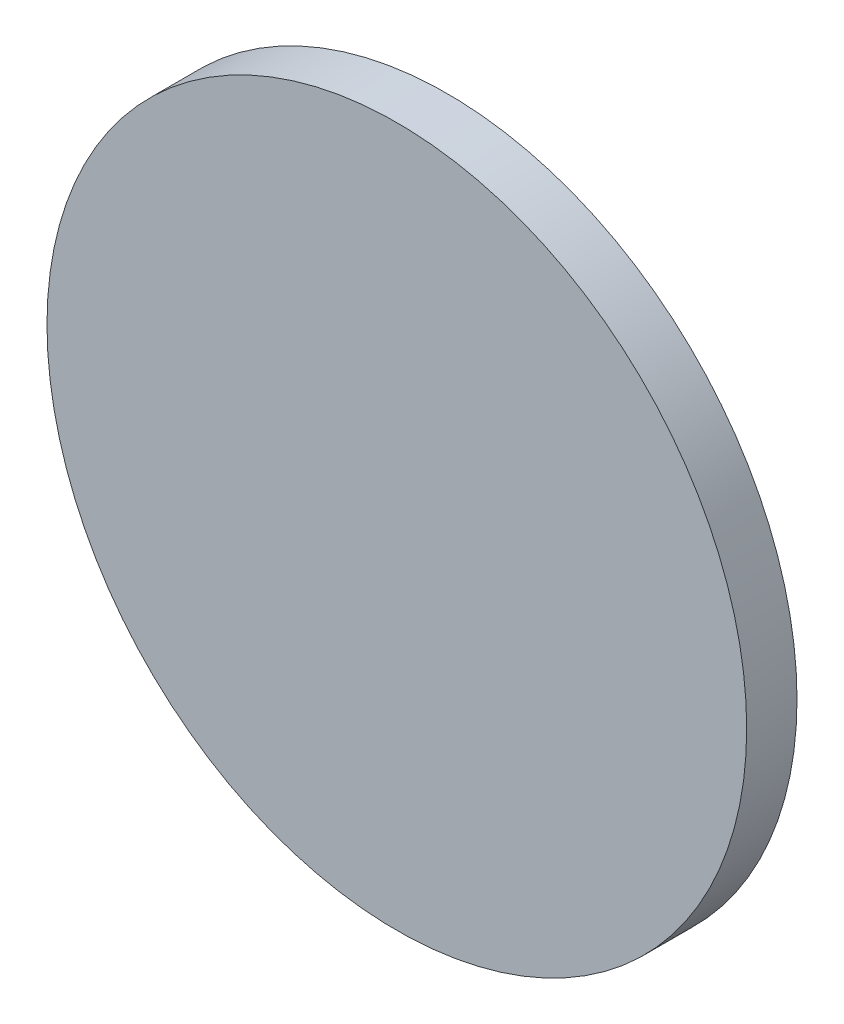
from build123d import *

# Parameters (mm, degrees)
SKETCH3_R           = 38.25
BOSS_EXTRUDE1_DEPTH = 5.5


with BuildPart() as part:
    # Sketch3 → Boss-Extrude1 (new body)
    with BuildSketch(Plane.XY):
        Circle(SKETCH3_R)
    extrude(amount=BOSS_EXTRUDE1_DEPTH)


solid = part.part
